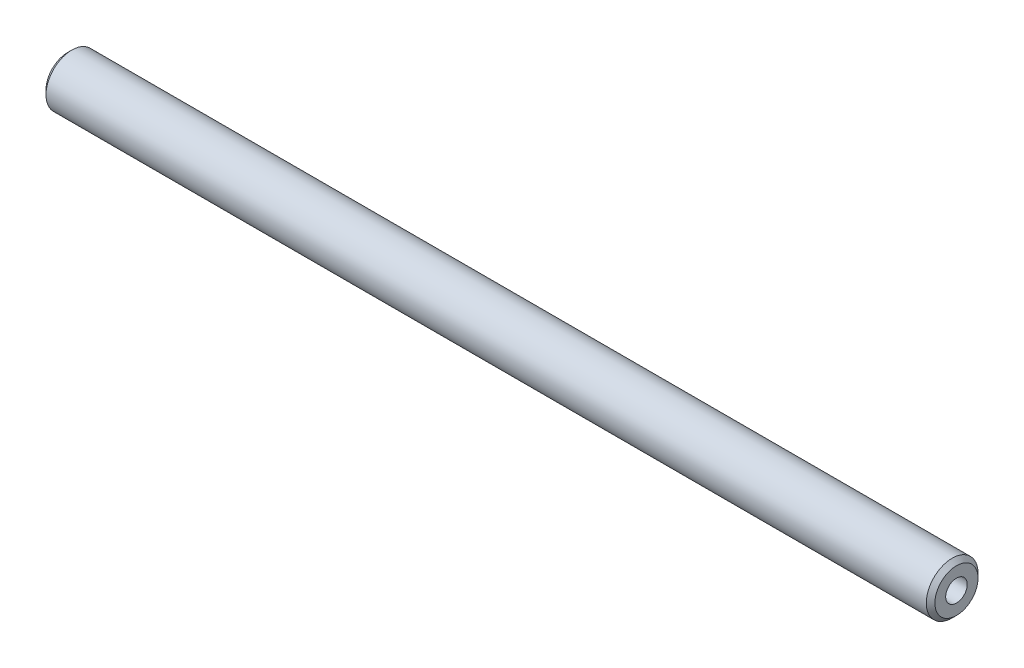
from build123d import *

# Parameters (mm, degrees)
SKETCH1_W          = 103
SKETCH1_H          = 3
TAPPED_HOLE1_D     = 2.5
TAPPED_HOLE1_DEPTH = 8.5
TAPPED_HOLE1_TIP   = 0.751075774
TAPPED_HOLE2_D     = 2.5
TAPPED_HOLE2_DEPTH = 8.5
TAPPED_HOLE2_TIP   = 0.751075774
CHAMFER1_SIZE      = 0.5


with BuildPart() as part:
    # Sketch1 → Revolve1 (revolve)
    with BuildSketch(Plane.XY):
        with Locations((51.5, 1.5)):
            Rectangle(SKETCH1_W, SKETCH1_H)
    revolve(axis=Axis((0, 0, 0), (1, 0, 0)))

    # Tapped Hole1
    with Locations(Plane.ZY):
        with Locations((0, 0)):
            Hole(TAPPED_HOLE1_D / 2, depth=TAPPED_HOLE1_DEPTH)
            with Locations((0, 0, -(TAPPED_HOLE1_DEPTH + TAPPED_HOLE1_TIP / 2))):  # 118° drill point
                Cone(0, TAPPED_HOLE1_D / 2, TAPPED_HOLE1_TIP, mode=Mode.SUBTRACT)

    # Tapped Hole2
    with Locations(Plane(origin=(103, 0, 0), x_dir=(0, 0, -1), z_dir=(1, 0, 0))):
        with Locations((0, 0)):
            Hole(TAPPED_HOLE2_D / 2, depth=TAPPED_HOLE2_DEPTH)
            with Locations((0, 0, -(TAPPED_HOLE2_DEPTH + TAPPED_HOLE2_TIP / 2))):  # 118° drill point
                Cone(0, TAPPED_HOLE2_D / 2, TAPPED_HOLE2_TIP, mode=Mode.SUBTRACT)

    # Chamfer1
    chamfer1_edges = [part.edges().sort_by_distance(p)[0] for p in [
        (0, -3, 0),
        (103, -3, 0),
    ]]
    chamfer(chamfer1_edges, length=CHAMFER1_SIZE)


solid = part.part
